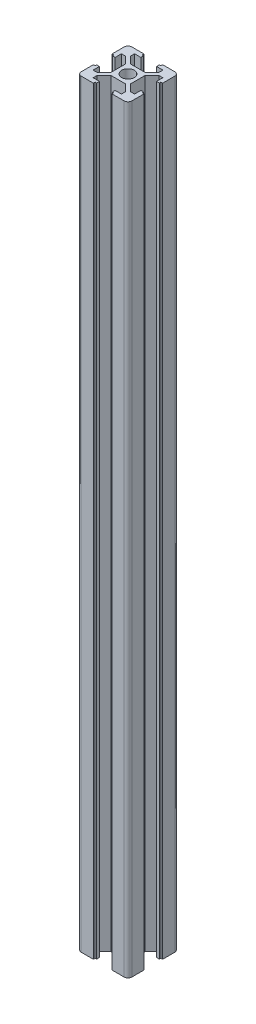
from build123d import *

# Parameters (mm, degrees)
SKETCH_1_R      = 2.5
EXTRUDE_1_DEPTH = 300
FILLET_1_R      = 1.5


with BuildPart() as part:
    # 草图1 → 凸台-拉伸1 (new body)
    with BuildSketch(Plane(origin=(0, 0, 0), x_dir=(1, 0, 0), z_dir=(0, 1, 0))):
        Polygon((10, 10), (3.65, 10), (3.65, 9.303257497), (3.1, 9.303257497), (3.1, 8.2), (5.6, 8.2), (5.6, 6.660660172), (2.839339828, 3.9), (-2.839339828, 3.9), (-5.6, 6.660660172), (-5.6, 8.2), (-3.1, 8.2), (-3.1, 9.303257497), (-3.65, 9.303257497), (-3.65, 10), (-10, 10), (-10, 3.65), (-9.303257497, 3.65), (-9.303257497, 3.1), (-8.2, 3.1), (-8.2, 5.6), (-6.660660172, 5.6), (-3.9, 2.839339828), (-3.9, -2.839339828), (-6.660660172, -5.6), (-8.2, -5.6), (-8.2, -3.1), (-9.303257497, -3.1), (-9.303257497, -3.65), (-10, -3.65), (-10, -10), (-3.65, -10), (-3.65, -9.303257497), (-3.1, -9.303257497), (-3.1, -8.2), (-5.6, -8.2), (-5.6, -6.660660172), (-2.839339828, -3.9), (2.839339828, -3.9), (5.6, -6.660660172), (5.6, -8.2), (3.1, -8.2), (3.1, -9.303257497), (3.65, -9.303257497), (3.65, -10), (10, -10), (10, -3.65), (9.303257497, -3.65), (9.303257497, -3.1), (8.2, -3.1), (8.2, -5.6), (6.660660172, -5.6), (3.9, -2.839339828), (3.9, 2.839339828), (6.660660172, 5.6), (8.2, 5.6), (8.2, 3.1), (9.303257497, 3.1), (9.303257497, 3.65), (10, 3.65), align=None)
        with Locations(Location((0, 0, 0), (0, 0, 270))):
            Circle(SKETCH_1_R, mode=Mode.SUBTRACT)
    extrude(amount=EXTRUDE_1_DEPTH)

    # 圆角1
    fillet_1_edges = [part.edges().sort_by_distance(p)[0] for p in [
        (10, 150, 10),
        (-10, 150, 10),
        (-10, 150, -10),
        (10, 150, -10),
    ]]
    fillet(fillet_1_edges, radius=FILLET_1_R)


solid = part.part
